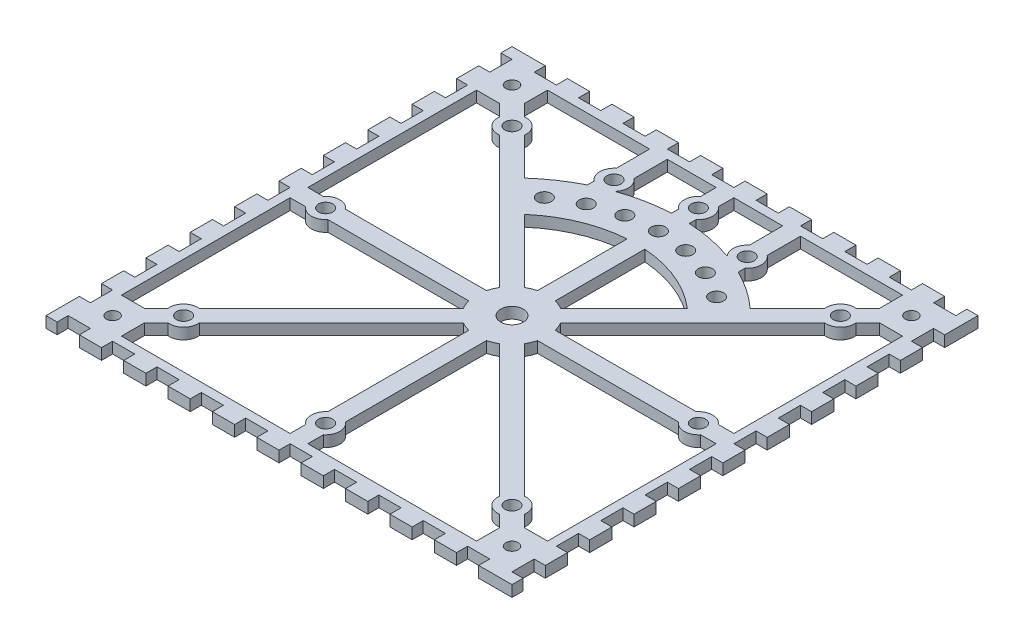
from build123d import *

# Parameters (mm, degrees)
SKETCH1_R           = 2.55
SKETCH1_R_2         = 1.6
SKETCH1_R_3         = 1.4
BOSS_EXTRUDE1_DEPTH = 2.5


with BuildPart() as part:
    # Sketch1 → Boss-Extrude1 (new body)
    with BuildSketch(Plane(origin=(0, 0, 0), x_dir=(1, 0, 0), z_dir=(0, 1, 0))):
        Polygon((-50, 52.5), (-45, 52.5), (-45, 50), (-40, 50), (-40, 52.5), (-35, 52.5), (-35, 50), (-30, 50), (-30, 52.5), (-25, 52.5), (-25, 50), (-20, 50), (-20, 52.5), (-15, 52.5), (-15, 50), (-10, 50), (-10, 52.5), (-5, 52.5), (-5, 50), (0, 50), (0, 52.5), (5, 52.5), (5, 50), (10, 50), (10, 52.5), (15, 52.5), (15, 50), (20, 50), (20, 52.5), (25, 52.5), (25, 50), (30, 50), (30, 52.5), (35, 52.5), (35, 50), (40, 50), (40, 52.5), (45, 52.5), (45, 50), (50, 50), (50, 52.5), (52.5, 52.5), (52.5, 50), (52.5, 45), (50, 45), (50, 40), (52.5, 40), (52.5, 35), (50, 35), (50, 30), (52.5, 30), (52.5, 25), (50, 25), (50, 20), (52.5, 20), (52.5, 15), (50, 15), (50, 10), (52.5, 10), (52.5, 5), (50, 5), (50, 0), (52.5, 0), (52.5, -5), (50, -5), (50, -10), (52.5, -10), (52.5, -15), (50, -15), (50, -20), (52.5, -20), (52.5, -25), (50, -25), (50, -30), (52.5, -30), (52.5, -35), (50, -35), (50, -40), (52.5, -40), (52.5, -45), (50, -45), (50, -50), (52.5, -50), (52.5, -52.5), (50, -52.5), (45, -52.5), (45, -50), (40, -50), (40, -52.5), (35, -52.5), (35, -50), (30, -50), (30, -52.5), (25, -52.5), (25, -50), (20, -50), (20, -52.5), (15, -52.5), (15, -50), (10, -50), (10, -52.5), (5, -52.5), (5, -50), (0, -50), (0, -52.5), (-5, -52.5), (-5, -50), (-10, -50), (-10, -52.5), (-15, -52.5), (-15, -50), (-20, -50), (-20, -52.5), (-25, -52.5), (-25, -50), (-30, -50), (-30, -52.5), (-35, -52.5), (-35, -50), (-40, -50), (-40, -52.5), (-45, -52.5), (-45, -50), (-50, -50), (-50, -52.5), (-52.5, -52.5), (-52.5, -50), (-52.5, -45), (-50, -45), (-50, -40), (-52.5, -40), (-52.5, -35), (-50, -35), (-50, -30), (-52.5, -30), (-52.5, -25), (-50, -25), (-50, -20), (-52.5, -20), (-52.5, -15), (-50, -15), (-50, -10), (-52.5, -10), (-52.5, -5), (-50, -5), (-50, 0), (-52.5, 0), (-52.5, 5), (-50, 5), (-50, 10), (-52.5, 10), (-52.5, 15), (-50, 15), (-50, 20), (-52.5, 20), (-52.5, 25), (-50, 25), (-50, 30), (-52.5, 30), (-52.5, 35), (-50, 35), (-50, 40), (-52.5, 40), (-52.5, 45), (-50, 45), (-50, 50), (-52.5, 50), (-52.5, 52.5), align=None)
        with Locations(Location((0, 0, 0), (0, 0, 270))):
            Circle(SKETCH1_R, mode=Mode.SUBTRACT)
        with Locations(Location((37, -37, 0), (0, 0, 270))):
            Circle(SKETCH1_R_2, mode=Mode.SUBTRACT)
        with Locations(Location((-37, -37, 0), (0, 0, 270))):
            Circle(SKETCH1_R_2, mode=Mode.SUBTRACT)
        with Locations(Location((-37, 37, 0), (0, 0, 270))):
            Circle(SKETCH1_R_2, mode=Mode.SUBTRACT)
        with Locations(Location((37, 37, 0), (0, 0, 270))):
            Circle(SKETCH1_R_2, mode=Mode.SUBTRACT)
        with Locations(Location((0, 42, 0), (0, 0, 270))):
            Circle(SKETCH1_R_2, mode=Mode.SUBTRACT)
        with Locations(Location((42, 0, 0), (0, 0, 270))):
            Circle(SKETCH1_R_2, mode=Mode.SUBTRACT)
        with Locations(Location((-42, 0, 0), (0, 0, 270))):
            Circle(SKETCH1_R_2, mode=Mode.SUBTRACT)
        with Locations(Location((0, -42, 0), (0, 0, 270))):
            Circle(SKETCH1_R_2, mode=Mode.SUBTRACT)
        with Locations(Location((-45, 45, 0), (0, 0, 270))):
            Circle(SKETCH1_R_3, mode=Mode.SUBTRACT)
        with Locations(Location((45, 45, 0), (0, 0, 270))):
            Circle(SKETCH1_R_3, mode=Mode.SUBTRACT)
        with Locations(Location((-45, -45, 0), (0, 0, 270))):
            Circle(SKETCH1_R_3, mode=Mode.SUBTRACT)
        with Locations(Location((45, -45, 0), (0, 0, 270))):
            Circle(SKETCH1_R_3, mode=Mode.SUBTRACT)
        with Locations(Location((-15, 38, 0), (0, 0, 270))):
            Circle(SKETCH1_R_2, mode=Mode.SUBTRACT)
        with Locations(Location((15, 38, 0), (0, 0, 270))):
            Circle(SKETCH1_R_2, mode=Mode.SUBTRACT)
        with Locations(Location((0, 33, 0), (0, 0, 270))):
            Circle(SKETCH1_R_2, mode=Mode.SUBTRACT)
        with Locations(Location((6.861085797, 32.278870824, 0), (0, 0, 270))):
            Circle(SKETCH1_R_2, mode=Mode.SUBTRACT)
        with Locations(Location((13.422309222, 30.147000102, 0), (0, 0, 270))):
            Circle(SKETCH1_R_2, mode=Mode.SUBTRACT)
        with Locations(Location((19.396913326, 26.697560814, 0), (0, 0, 270))):
            Circle(SKETCH1_R_2, mode=Mode.SUBTRACT)
        with Locations(Location((-19.396913326, 26.697560814, 0), (0, 0, 270))):
            Circle(SKETCH1_R_2, mode=Mode.SUBTRACT)
        with Locations(Location((-13.422309221, 30.147000102, 0), (0, 0, 270))):
            Circle(SKETCH1_R_2, mode=Mode.SUBTRACT)
        with Locations(Location((-6.861085797, 32.278870824, 0), (0, 0, 270))):
            Circle(SKETCH1_R_2, mode=Mode.SUBTRACT)
        with BuildLine():
            Line((-40, 48), (-17, 48))
            Line((-17, 48), (-17, 40.497999199))
            ThreePointArc((-17, 40.497999199), (-18.2, 38), (-17, 35.502000801))
            Line((-17, 35.502000801), (-17, 33.985290936))
            ThreePointArc((-17, 33.985290936), (-21.402484999, 31.399580186), (-25.418602168, 28.247029292))
            Line((-25.418602168, 28.247029292), (-33.819434264, 36.647861389))
            ThreePointArc((-33.819434264, 36.647861389), (-34.7372583, 39.2627417), (-37.352138611, 40.180565736))
            Line((-37.352138611, 40.180565736), (-40, 42.828427125))
            Line((-40, 42.828427125), (-40, 48))
        make_face(mode=Mode.SUBTRACT)
        with BuildLine():
            Line((-48, 40), (-48, 2))
            Line((-48, 2), (-44.497999199, 2))
            ThreePointArc((-44.497999199, 2), (-42, 3.2), (-39.502000801, 2))
            Line((-39.502000801, 2), (-7.745966692, 2))
            ThreePointArc((-7.745966692, 2), (-7.39103626, 3.061467459), (-6.891439137, 4.063012013))
            Line((-6.891439137, 4.063012013), (-36.647861389, 33.819434264))
            ThreePointArc((-36.647861389, 33.819434264), (-39.2627417, 34.7372583), (-40.180565736, 37.352138611))
            Line((-40.180565736, 37.352138611), (-42.828427125, 40))
            Line((-42.828427125, 40), (-48, 40))
        make_face(mode=Mode.SUBTRACT)
        with BuildLine():
            Line((-40, -48), (-2, -48))
            Line((-2, -48), (-2, -44.497999199))
            ThreePointArc((-2, -44.497999199), (-3.2, -42), (-2, -39.502000801))
            Line((-2, -39.502000801), (-2, -7.745966692))
            ThreePointArc((-2, -7.745966692), (-3.061467459, -7.39103626), (-4.063012013, -6.891439137))
            Line((-4.063012013, -6.891439137), (-33.819434264, -36.647861389))
            ThreePointArc((-33.819434264, -36.647861389), (-34.7372583, -39.2627417), (-37.352138611, -40.180565736))
            Line((-37.352138611, -40.180565736), (-40, -42.828427125))
            Line((-40, -42.828427125), (-40, -48))
        make_face(mode=Mode.SUBTRACT)
        with BuildLine():
            Line((48, 40), (48, 2))
            Line((48, 2), (44.497999199, 2))
            ThreePointArc((44.497999199, 2), (42, 3.2), (39.502000801, 2))
            Line((39.502000801, 2), (7.745966692, 2))
            ThreePointArc((7.745966692, 2), (7.39103626, 3.061467459), (6.891439137, 4.063012013))
            Line((6.891439137, 4.063012013), (36.647861389, 33.819434264))
            ThreePointArc((36.647861389, 33.819434264), (39.2627417, 34.7372583), (40.180565736, 37.352138611))
            Line((40.180565736, 37.352138611), (42.828427125, 40))
            Line((42.828427125, 40), (48, 40))
        make_face(mode=Mode.SUBTRACT)
        with BuildLine():
            Line((48, -2), (48, -40))
            Line((48, -40), (42.828427125, -40))
            Line((42.828427125, -40), (40.180565736, -37.352138611))
            ThreePointArc((40.180565736, -37.352138611), (39.2627417, -34.7372583), (36.647861389, -33.819434264))
            Line((36.647861389, -33.819434264), (6.891439137, -4.063012013))
            ThreePointArc((6.891439137, -4.063012013), (7.39103626, -3.061467459), (7.745966692, -2))
            Line((7.745966692, -2), (39.502000801, -2))
            ThreePointArc((39.502000801, -2), (42, -3.2), (44.497999199, -2))
            Line((44.497999199, -2), (48, -2))
        make_face(mode=Mode.SUBTRACT)
        with BuildLine():
            Line((40, -42.828427125), (37.352138611, -40.180565736))
            ThreePointArc((37.352138611, -40.180565736), (34.7372583, -39.2627417), (33.819434264, -36.647861389))
            Line((33.819434264, -36.647861389), (4.063012013, -6.891439137))
            ThreePointArc((4.063012013, -6.891439137), (3.061467459, -7.39103626), (2, -7.745966692))
            Line((2, -7.745966692), (2, -39.502000801))
            ThreePointArc((2, -39.502000801), (3.2, -42), (2, -44.497999199))
            Line((2, -44.497999199), (2, -48))
            Line((2, -48), (40, -48))
            Line((40, -48), (40, -42.828427125))
        make_face(mode=Mode.SUBTRACT)
        with BuildLine():
            Line((-48, -2), (-44.497999199, -2))
            ThreePointArc((-44.497999199, -2), (-42, -3.2), (-39.502000801, -2))
            Line((-39.502000801, -2), (-7.745966692, -2))
            ThreePointArc((-7.745966692, -2), (-7.39103626, -3.061467459), (-6.891439137, -4.063012013))
            Line((-6.891439137, -4.063012013), (-36.647861389, -33.819434264))
            ThreePointArc((-36.647861389, -33.819434264), (-39.2627417, -34.7372583), (-40.180565736, -37.352138611))
            Line((-40.180565736, -37.352138611), (-42.828427125, -40))
            Line((-42.828427125, -40), (-48, -40))
            Line((-48, -40), (-48, -2))
        make_face(mode=Mode.SUBTRACT)
        with BuildLine():
            Line((2, 48), (2, 44.497999199))
            ThreePointArc((2, 44.497999199), (3.2, 42), (2, 39.502000801))
            Line((2, 39.502000801), (2, 37.947331922))
            ThreePointArc((2, 37.947331922), (7.397643577, 37.272977739), (12.643700473, 35.834855076))
            ThreePointArc((12.643700473, 35.834855076), (11.809300285, 38.243793623), (13, 40.497999199))
            Line((13, 40.497999199), (13, 48))
            Line((13, 48), (2, 48))
        make_face(mode=Mode.SUBTRACT)
        with BuildLine():
            Line((-2, 39.502000801), (-2, 37.947331922))
            ThreePointArc((-2, 37.947331922), (-7.397643577, 37.272977739), (-12.643700473, 35.834855076))
            ThreePointArc((-12.643700473, 35.834855076), (-11.809300285, 38.243793623), (-13, 40.497999199))
            Line((-13, 40.497999199), (-13, 48))
            Line((-13, 48), (-2, 48))
            Line((-2, 48), (-2, 44.497999199))
            ThreePointArc((-2, 44.497999199), (-3.2, 42), (-2, 39.502000801))
        make_face(mode=Mode.SUBTRACT)
        with BuildLine():
            Line((33.819434264, 36.647861389), (25.418602168, 28.247029292))
            ThreePointArc((25.418602168, 28.247029292), (21.402484999, 31.399580186), (17, 33.985290936))
            Line((17, 33.985290936), (17, 35.502000801))
            ThreePointArc((17, 35.502000801), (18.2, 38), (17, 40.497999199))
            Line((17, 40.497999199), (17, 48))
            Line((17, 48), (40, 48))
            Line((40, 48), (40, 42.828427125))
            Line((40, 42.828427125), (37.352138611, 40.180565736))
            ThreePointArc((37.352138611, 40.180565736), (34.7372583, 39.2627417), (33.819434264, 36.647861389))
        make_face(mode=Mode.SUBTRACT)
        with BuildLine():
            Line((-18.334204096, 21.162631221), (-4.063012013, 6.891439137))
            ThreePointArc((-4.063012013, 6.891439137), (-3.061467459, 7.39103626), (-2, 7.745966692))
            Line((-2, 7.745966692), (-2, 27.928480088))
            ThreePointArc((-2, 27.928480088), (-10.715136106, 25.86862691), (-18.334204096, 21.162631221))
        make_face(mode=Mode.SUBTRACT)
        with BuildLine():
            Line((18.334204096, 21.16263122), (4.063012013, 6.891439137))
            ThreePointArc((4.063012013, 6.891439137), (3.061467459, 7.39103626), (2, 7.745966692))
            Line((2, 7.745966692), (2, 27.928480088))
            ThreePointArc((2, 27.928480088), (10.715136106, 25.86862691), (18.334204096, 21.16263122))
        make_face(mode=Mode.SUBTRACT)
    extrude(amount=BOSS_EXTRUDE1_DEPTH)


solid = part.part
